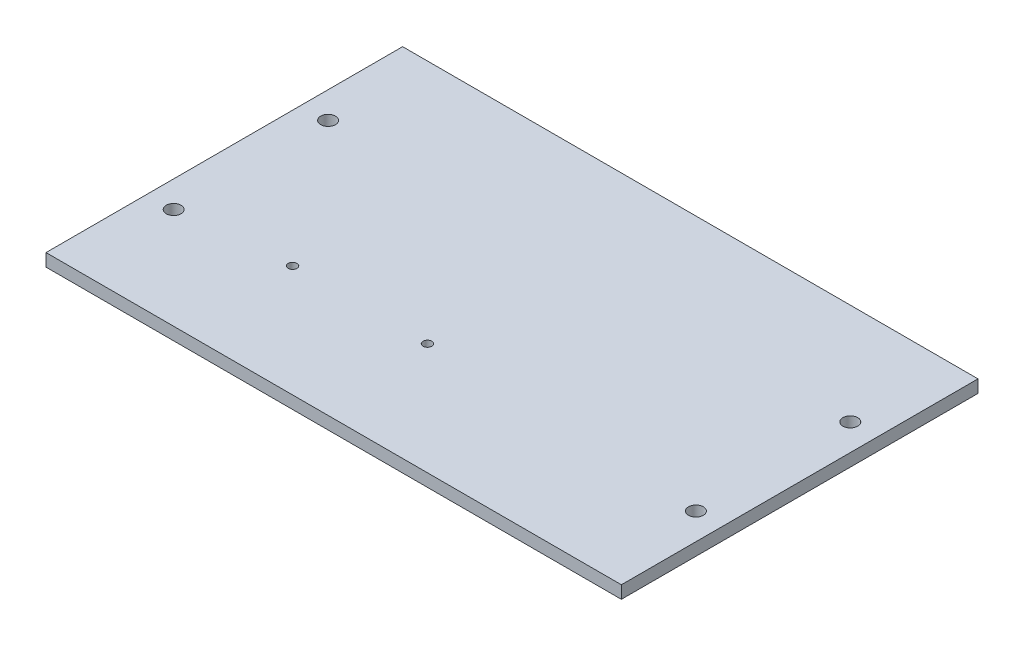
from build123d import *

# Parameters (mm, degrees)
SKETCH1_W           = 216.78392
SKETCH1_H           = 134.366
SKETCH1_R           = 1.651
SKETCH1_R_2         = 2.794
BOSS_EXTRUDE1_DEPTH = 4.7625


with BuildPart() as part:
    # Sketch1 → Boss-Extrude1 (new body)
    with BuildSketch(Plane(origin=(0, 0, 0), x_dir=(1, 0, 0), z_dir=(0, 1, 0))):
        with Locations((108.39196, 67.183)):
            Rectangle(SKETCH1_W, SKETCH1_H)
        with Locations(Location((50.8, 42.100673529, 0), (0, 0, 90))):
            Circle(SKETCH1_R, mode=Mode.SUBTRACT)
        with Locations(Location((101.6, 42.100673529, 0), (0, 0, 90))):
            Circle(SKETCH1_R, mode=Mode.SUBTRACT)
        with Locations(Location((10.0076, 96.266, 0), (0, 0, 90))):
            Circle(SKETCH1_R_2, mode=Mode.SUBTRACT)
        with Locations(Location((10.0076, 38.1, 0), (0, 0, 90))):
            Circle(SKETCH1_R_2, mode=Mode.SUBTRACT)
        with Locations(Location((206.77632, 96.266, 0), (0, 0, 90))):
            Circle(SKETCH1_R_2, mode=Mode.SUBTRACT)
        with Locations(Location((206.77632, 38.1, 0), (0, 0, 90))):
            Circle(SKETCH1_R_2, mode=Mode.SUBTRACT)
    extrude(amount=BOSS_EXTRUDE1_DEPTH)


solid = part.part
